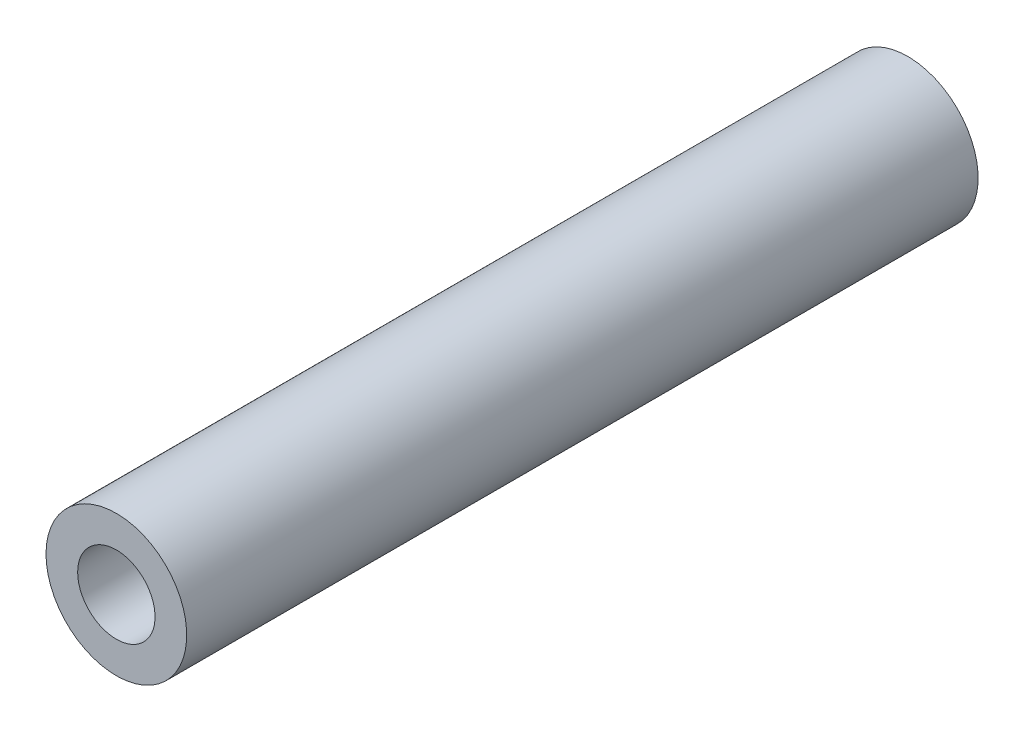
from build123d import *

# Parameters (mm, degrees)
M4_SLEEVE_PROFILE_R   = 4
M4_SLEEVE_PROFILE_R_2 = 2.2
M4_SLEEVE_DEPTH       = 45


with BuildPart() as part:
    # M4 sleeve profile → M4 sleeve (new body)
    with BuildSketch(Plane.XY):
        with Locations(Location((0, 0, 0), (0, 0, 180))):
            Circle(M4_SLEEVE_PROFILE_R)
        with Locations(Location((0, 0, 0), (0, 0, 180))):
            Circle(M4_SLEEVE_PROFILE_R_2, mode=Mode.SUBTRACT)
    extrude(amount=M4_SLEEVE_DEPTH)


solid = part.part
